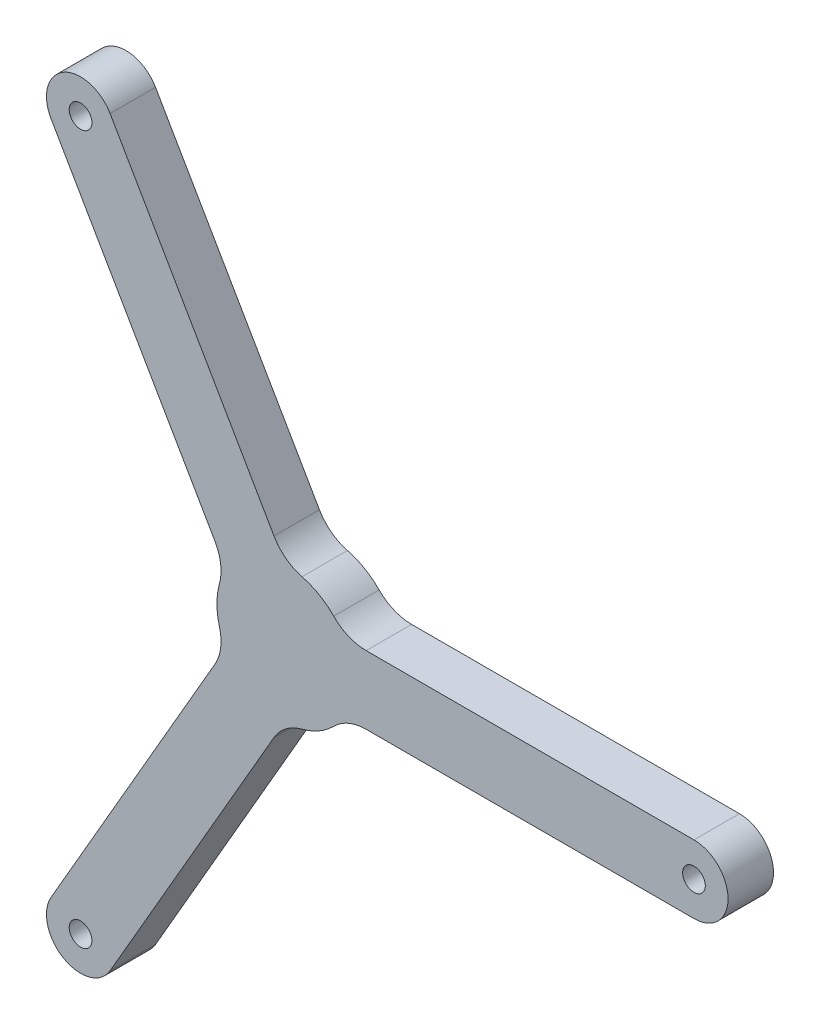
from build123d import *

# Parameters (mm, degrees)
SKETCH1_R                = 2.5
BOSS_EXTRUDE1_DEPTH      = 10
FILLET1_R                = 10
CIRPATTERN2_COUNT        = 3
FILLET1_OF_CIRPATTERN2_R = 10


with BuildPart() as part:
    # Sketch1 → Boss-Extrude1 (new body)
    with BuildSketch(Plane.XY):
        with BuildLine():
            Line((12.990381057, -7.5), (90, -7.5))
            ThreePointArc((90, -7.5), (97.5, 0), (90, 7.5))
            Line((90, 7.5), (12.990381057, 7.5))
            ThreePointArc((12.990381057, 7.5), (-15, 0), (12.990381057, -7.5))
        make_face()
        with Locations((90, 0)):
            Circle(SKETCH1_R, mode=Mode.SUBTRACT)
    boss_extrude1 = extrude(amount=BOSS_EXTRUDE1_DEPTH)

    # Fillet1
    fillet1_edges = [part.edges().sort_by_distance(p)[0] for p in [
        (12.990381057, -7.5, 5),
        (12.990381057, 7.5, 5),
    ]]
    fillet(fillet1_edges, radius=FILLET1_R)

    # CirPattern2: Boss-Extrude1 ×3 about axis
    cirpattern2_axis = Axis((0, 0, 0), (0, 0, 1))
    for i in range(1, CIRPATTERN2_COUNT):
        add(boss_extrude1.rotate(cirpattern2_axis, i * 360 / CIRPATTERN2_COUNT))

    # Fillet1 of CirPattern2
    fillet1_of_cirpattern2_edges = [part.edges().sort_by_distance(p)[0] for p in [
        (0, 15, 5),
        (-12.990381057, 7.5, 5),
        (-12.990381057, -7.5, 5),
        (0, -15, 5),
    ]]
    fillet(fillet1_of_cirpattern2_edges, radius=FILLET1_OF_CIRPATTERN2_R)


solid = part.part
